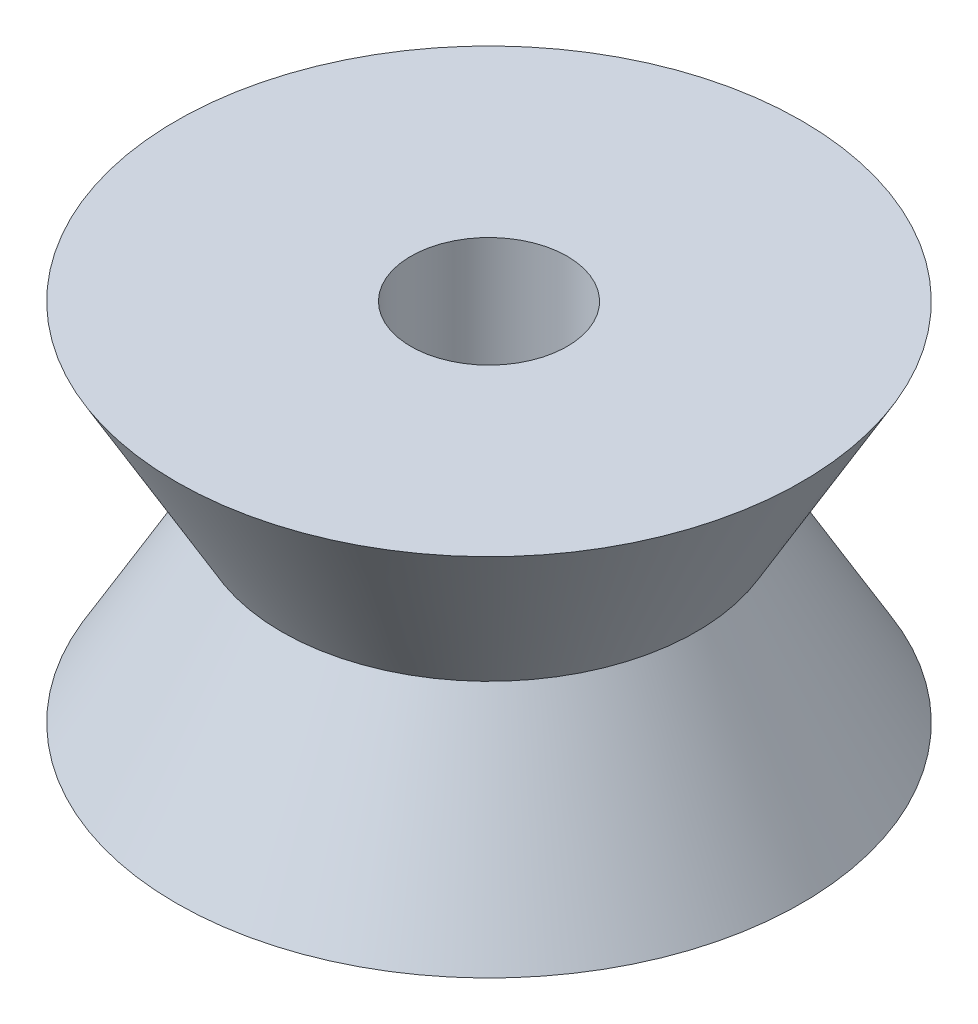
from build123d import *


with BuildPart() as part:
    # Esquisse2 → Révolution1 (revolve)
    with BuildSketch(Plane.XY, mode=Mode.PRIVATE) as r_volution1_sk:
        Polygon((1.5, -3.5), (1.5, 3.5), (6, 3.5), (3.979274058, 0), (6, -3.5), align=None)
    revolve(r_volution1_sk.sketch.rotate(Axis((0, 0, 0), (0, 1, 0)), 90), axis=Axis((0, 0, 0), (0, 1, 0)))


solid = part.part
